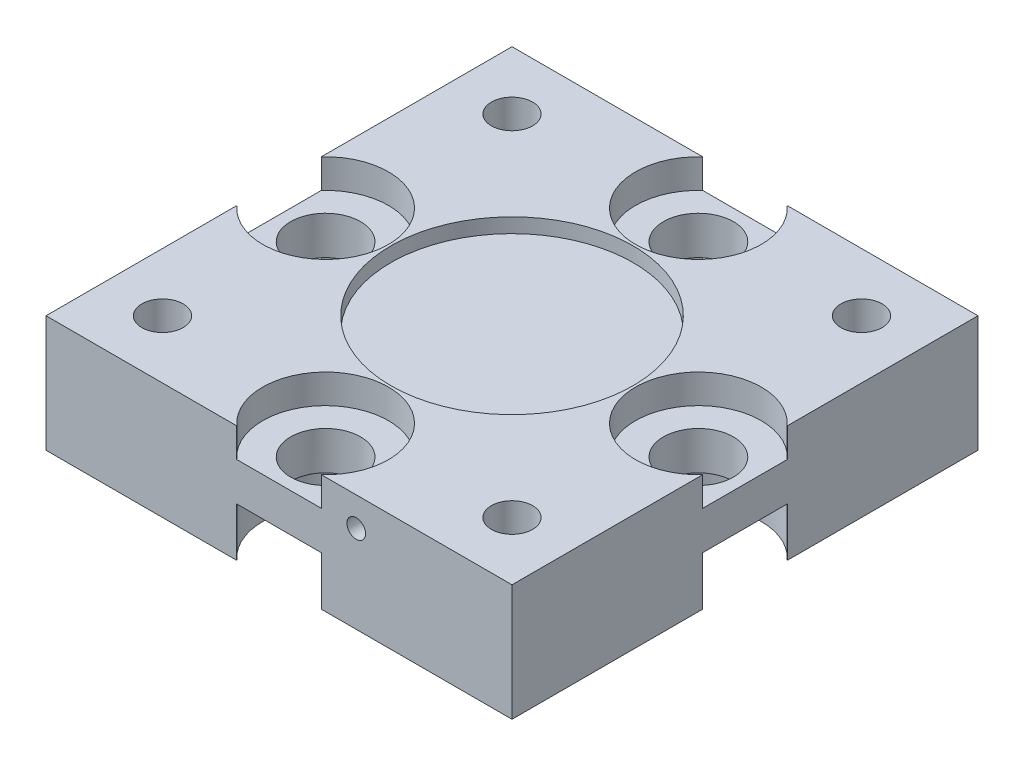
from build123d import *

# Parameters (mm, degrees)
SKETCH1_W             = 50.8
SKETCH1_H             = 50.8
BOSS_EXTRUDE1_DEPTH   = 12.7
F_8_CLEARANCE_HOLE1_D = 4.4958
SKETCH5_R             = 13.208
CUT_EXTRUDE1_DEPTH    = 1.5875
SKETCH6_R             = 3.81
CUT_EXTRUDE2_DEPTH    = 39.1
SKETCH10_R            = 6.858
CUT_EXTRUDE3_DEPTH    = 3.175
CUT_EXTRUDE4_START    = -5.334
SKETCH11_R            = 6.858
CUT_EXTRUDE4_DEPTH    = 5.334
SKETCH12_R            = 1.016
CUT_EXTRUDE5_DEPTH    = 19.05
CUT_EXTRUDE6_START    = -19.05
SKETCH13_R            = 1.016
CUT_EXTRUDE6_DEPTH    = 19.05


with BuildPart() as part:
    # Sketch1 → Boss-Extrude1 (new body)
    with BuildSketch(Plane(origin=(0, 0, 0), x_dir=(1, 0, 0), z_dir=(0, 1, 0))):
        Rectangle(SKETCH1_W, SKETCH1_H)
    extrude(amount=BOSS_EXTRUDE1_DEPTH)

    # #8 Clearance Hole1 (through all)
    with Locations(Plane(origin=(0, 12.7, 0), x_dir=(1, 0, 0), z_dir=(0, 1, 0))):
        with Locations((-19.05, -19.05), (-19.05, 19.05), (19.05, 19.05), (19.05, -19.05)):
            Hole(F_8_CLEARANCE_HOLE1_D / 2)

    # Sketch5 → Cut-Extrude1 (cut)
    with BuildSketch(Plane(origin=(0, 12.7, 0), x_dir=(1, 0, 0), z_dir=(0, 1, 0))):
        with Locations(Location((0, 0, 0), (0, 0, 270))):
            Circle(SKETCH5_R)
    extrude(amount=-CUT_EXTRUDE1_DEPTH, mode=Mode.SUBTRACT)

    # Sketch6 → Cut-Extrude2 (cut, through all)
    with BuildSketch(Plane(origin=(0, 12.7, 0), x_dir=(1, 0, 0), z_dir=(0, 1, 0))):
        with Locations(Location((0, 20.32, 0), (0, 0, 270))):
            Circle(SKETCH6_R)
        with Locations(Location((20.32, 0, 0), (0, 0, 270))):
            Circle(SKETCH6_R)
        with Locations(Location((0, -20.32, 0), (0, 0, 270))):
            Circle(SKETCH6_R)
        with Locations(Location((-20.32, 0, 0), (0, 0, 270))):
            Circle(SKETCH6_R)
    extrude(amount=-CUT_EXTRUDE2_DEPTH, mode=Mode.SUBTRACT)

    # Sketch10 → Cut-Extrude3 (cut)
    with BuildSketch(Plane(origin=(0, 12.7, 0), x_dir=(1, 0, 0), z_dir=(0, 1, 0))):
        with Locations((-20.32, 0)):
            Circle(SKETCH10_R)
        with Locations((0, 20.32)):
            Circle(SKETCH10_R)
        with Locations((20.32, 0)):
            Circle(SKETCH10_R)
        with Locations((0, -20.32)):
            Circle(SKETCH10_R)
    extrude(amount=-CUT_EXTRUDE3_DEPTH, mode=Mode.SUBTRACT)

    # Sketch11 → Cut-Extrude4 (cut)
    with BuildSketch(Plane.XZ.offset(CUT_EXTRUDE4_START)):
        with Locations((-20.32, 0)):
            Circle(SKETCH11_R)
        with Locations((0, 20.32)):
            Circle(SKETCH11_R)
        with Locations((20.32, 0)):
            Circle(SKETCH11_R)
        with Locations((0, -20.32)):
            Circle(SKETCH11_R)
    extrude(amount=CUT_EXTRUDE4_DEPTH, mode=Mode.SUBTRACT)

    # Sketch12 → Cut-Extrude5 (cut)
    with BuildSketch(Plane.XY.offset(25.4)):
        with Locations((8.417142715, 9.525)):
            Circle(SKETCH12_R)
    extrude(amount=-CUT_EXTRUDE5_DEPTH, mode=Mode.SUBTRACT)

    # Sketch13 → Cut-Extrude6 (cut)
    with BuildSketch(Plane(origin=(0, 0, -25.4), x_dir=(-1, 0, 0), z_dir=(0, 0, -1)).offset(CUT_EXTRUDE6_START)):
        with Locations(Location((-8.417142715, 9.525, 0), (0, 0, 180))):
            Circle(SKETCH13_R)
    extrude(amount=CUT_EXTRUDE6_DEPTH, mode=Mode.SUBTRACT)


solid = part.part
